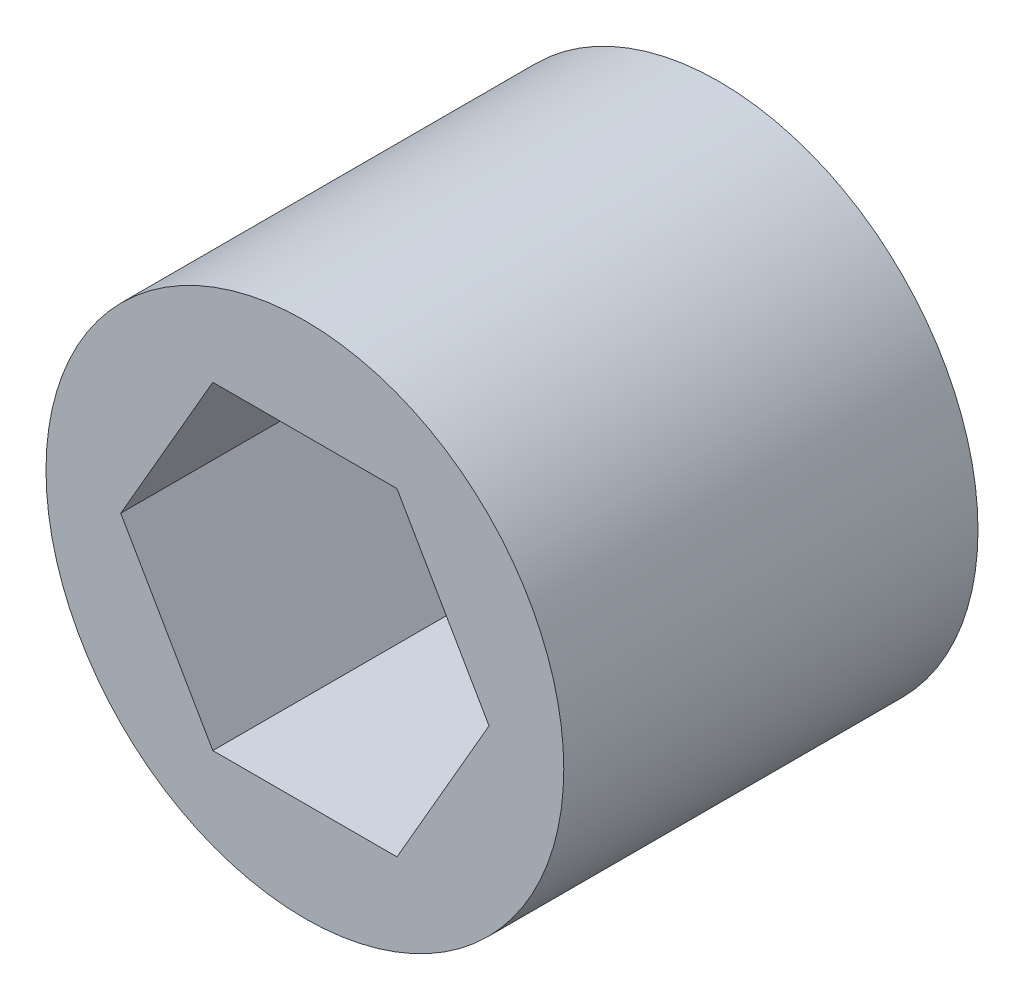
from build123d import *

# Parameters (mm, degrees)
SKETCH2_R           = 7.9375
BOSS_EXTRUDE2_DEPTH = 6.35


with BuildPart() as part:
    # Sketch2 → Boss-Extrude2 (new, symmetric)
    with BuildSketch(Plane.XY):
        with Locations(Location((0, 0, 0), (0, 0, 180))):
            Circle(SKETCH2_R)
        Polygon((-2.822954141, 4.8895), (-5.645908282, 0), (-2.822954141, -4.8895), (2.822954141, -4.8895), (5.645908282, 0), (2.822954141, 4.8895), align=None, mode=Mode.SUBTRACT)
    extrude(amount=BOSS_EXTRUDE2_DEPTH, both=True)


solid = part.part
